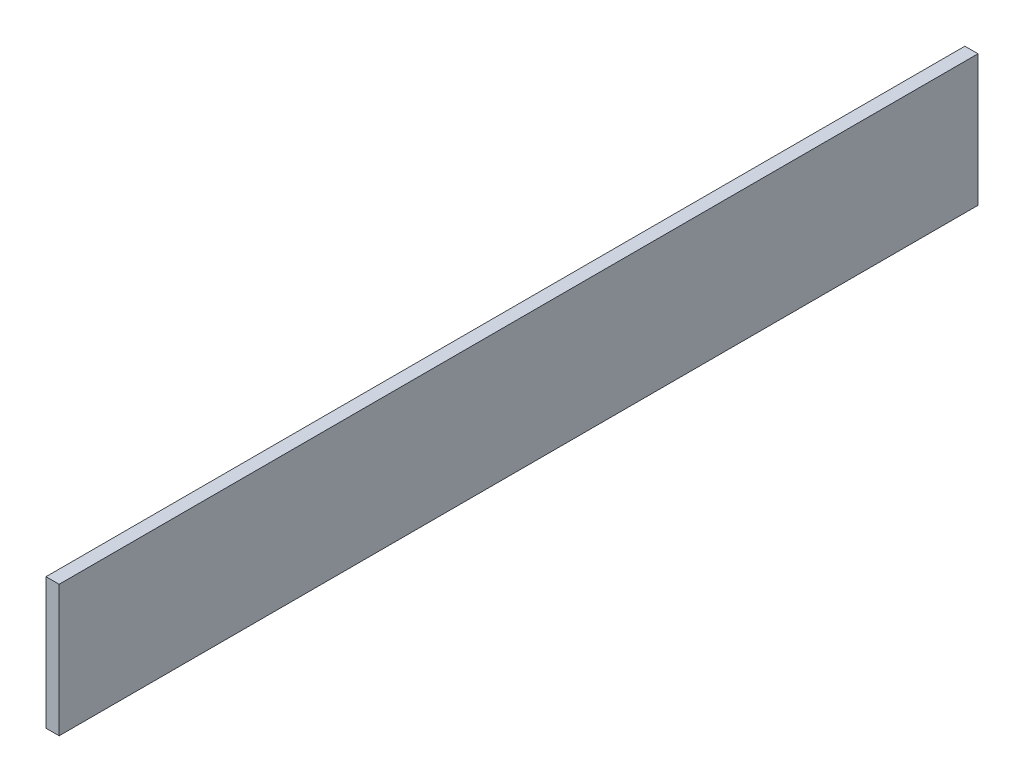
from build123d import *

# Parameters (mm, degrees)
SKETCH1_W           = 1
SKETCH1_H           = 70
BOSS_EXTRUDE1_DEPTH = 10


with BuildPart() as part:
    # Sketch1 → Boss-Extrude1 (new body)
    with BuildSketch(Plane(origin=(0, 0, 0), x_dir=(1, 0, 0), z_dir=(0, 1, 0))):
        with Locations((0.5, 35)):
            Rectangle(SKETCH1_W, SKETCH1_H)
    extrude(amount=BOSS_EXTRUDE1_DEPTH)


solid = part.part
